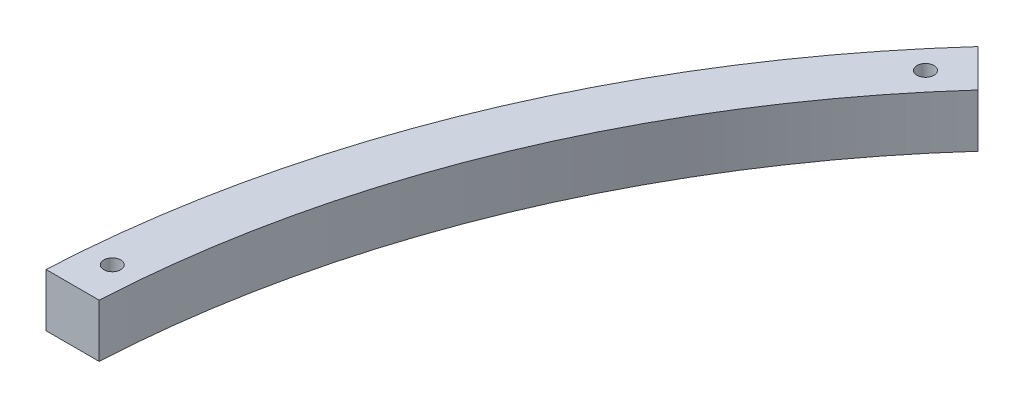
from build123d import *

# Parameters (mm, degrees)
BASE_DEPTH                 = 5
F_3_2_3_2_DIAMETER_HOLE1_D = 3.2


with BuildPart() as part:
    # Sketch1 → base (new, symmetric)
    with BuildSketch(Plane(origin=(0, 0, 0), x_dir=(1, 0, 0), z_dir=(0, 1, 0))):
        with BuildLine():
            Line((-141.235146462, 127.093010838), (-148.31553673, 134.173401106))
            ThreePointArc((-148.31553673, 134.173401106), (-184.775906502, 76.536686473), (-199.749843554, 10))
            Line((-199.749843554, 10), (-189.73665961, 10))
            ThreePointArc((-189.73665961, 10), (-175.537111177, 72.709852149), (-141.235146462, 127.093010838))
        make_face()
    extrude(amount=BASE_DEPTH, both=True)

    # Ø3.2 (3.2) Diameter Hole1 (through all)
    with Locations(Plane(origin=(0, 5, 0), x_dir=(1, 0, 0), z_dir=(0, 1, 0))):
        with Locations((-194.257966128, 16.995369836), (-149.378666408, 125.343583889)):
            Hole(F_3_2_3_2_DIAMETER_HOLE1_D / 2)


solid = part.part
